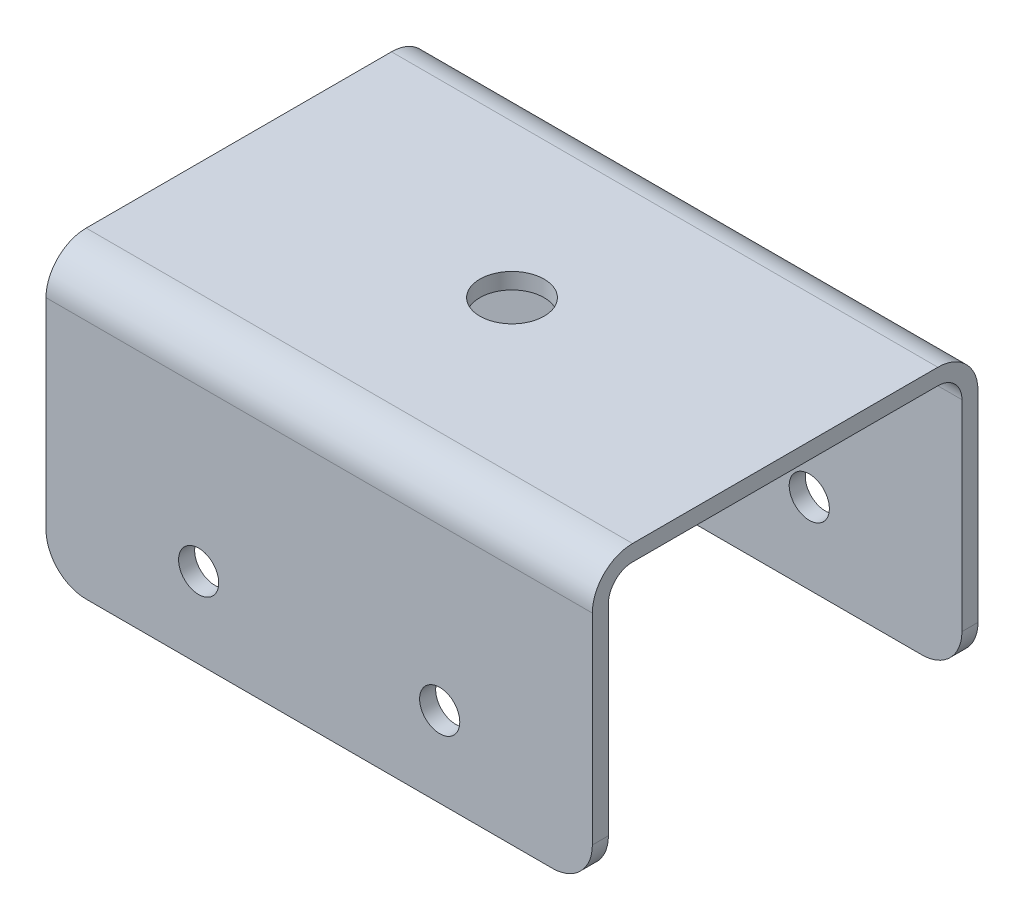
from build123d import *

# Parameters (mm, degrees)
SKETCH1_W                      = 68
SKETCH1_H                      = 48
BOSS_EXTRUDE1_DEPTH            = 35
SHELL1_T                       = -2
FILLET1_R                      = 5
FILLET2_R                      = 3
CUT_EXTRUDE1_REACH             = 80.467
CUT_EXTRUDE1_DIRECTION_2_REACH = 80.467
CUT_EXTRUDE2_DEPTH             = 55.378304497
CUT_EXTRUDE2_DEPTH_BACK        = 55.378304497
SKETCH3_R                      = 2.5
FILLET3_R                      = 5
SKETCH4_R                      = 4
CUT_EXTRUDE3_DEPTH             = 55.378304497


with BuildPart() as part:
    # Sketch1 → Boss-Extrude1 (new body)
    with BuildSketch(Plane(origin=(0, 0, 0), x_dir=(1, 0, 0), z_dir=(0, 1, 0))):
        Rectangle(SKETCH1_W, SKETCH1_H)
    extrude(amount=BOSS_EXTRUDE1_DEPTH)

    # Shell1
    shell1_openings = [part.faces().sort_by_distance(p)[0] for p in [
        (0, 0, 0),
    ]]
    offset(amount=SHELL1_T, openings=shell1_openings, kind=Kind.INTERSECTION)

    # Fillet1
    fillet1_edges = [part.edges().sort_by_distance(p)[0] for p in [
        (0, 35, 24),
        (0, 35, -24),
    ]]
    fillet(fillet1_edges, radius=FILLET1_R)

    # Fillet2
    fillet2_edges = [part.edges().sort_by_distance(p)[0] for p in [
        (0, 33, -22),
        (0, 33, 22),
    ]]
    fillet(fillet2_edges, radius=FILLET2_R)

    # Sketch2 → Cut-Extrude1 (cut, up to next)
    with BuildSketch(Plane(origin=(-32, 0, 0), x_dir=(0, 0, -1), z_dir=(1, 0, 0)), mode=Mode.PRIVATE) as cut_extrude1_sk1:
        with BuildLine():
            Line((22, 0), (22, 30))
            ThreePointArc((22, 30), (21.121320344, 32.121320344), (19, 33))
            Line((19, 33), (-19, 33))
            ThreePointArc((-19, 33), (-21.121320344, 32.121320344), (-22, 30))
            Line((-22, 30), (-22, 0))
            Line((-22, 0), (22, 0))
        make_face()
    cut_extrude1_tool1 = extrude(cut_extrude1_sk1.sketch, amount=-CUT_EXTRUDE1_REACH, mode=Mode.PRIVATE) & part.part
    add(cut_extrude1_tool1.solids().sort_by_distance((-32, 16.457775, 0))[0], mode=Mode.SUBTRACT)

    # Sketch2 → Cut-Extrude1 direction 2 (cut, up to next)
    with BuildSketch(Plane(origin=(-32, 0, 0), x_dir=(0, 0, -1), z_dir=(1, 0, 0)), mode=Mode.PRIVATE) as cut_extrude1_direction_2_sk1:
        with BuildLine():
            Line((22, 0), (22, 30))
            ThreePointArc((22, 30), (21.121320344, 32.121320344), (19, 33))
            Line((19, 33), (-19, 33))
            ThreePointArc((-19, 33), (-21.121320344, 32.121320344), (-22, 30))
            Line((-22, 30), (-22, 0))
            Line((-22, 0), (22, 0))
        make_face()
    cut_extrude1_direction_2_tool1 = extrude(cut_extrude1_direction_2_sk1.sketch, amount=CUT_EXTRUDE1_DIRECTION_2_REACH, mode=Mode.PRIVATE) & part.part
    add(cut_extrude1_direction_2_tool1.solids().sort_by_distance((-32, 16.457775, 0))[0], mode=Mode.SUBTRACT)

    # Sketch3 → Cut-Extrude2 (cut, two sides: drawn at the far end of the back side and taken through both)
    with BuildSketch(Plane.XY.offset(-CUT_EXTRUDE2_DEPTH_BACK)):
        with Locations((-15, 10)):
            Circle(SKETCH3_R)
        with Locations((15, 10)):
            Circle(SKETCH3_R)
    extrude(amount=CUT_EXTRUDE2_DEPTH + CUT_EXTRUDE2_DEPTH_BACK, mode=Mode.SUBTRACT)

    # Fillet3
    fillet3_edges = [part.edges().sort_by_distance(p)[0] for p in [
        (-34, 0, -23),
        (34, 0, -23),
        (-34, 0, 23),
        (34, 0, 23),
    ]]
    fillet(fillet3_edges, radius=FILLET3_R)

    # Sketch4 → Cut-Extrude3 (cut, through all)
    with BuildSketch(Plane(origin=(0, 35, 0), x_dir=(1, 0, 0), z_dir=(0, 1, 0))):
        with Locations(Location((0, 0, 0), (0, 0, 270))):
            Circle(SKETCH4_R)
    extrude(amount=-CUT_EXTRUDE3_DEPTH, mode=Mode.SUBTRACT)


solid = part.part
